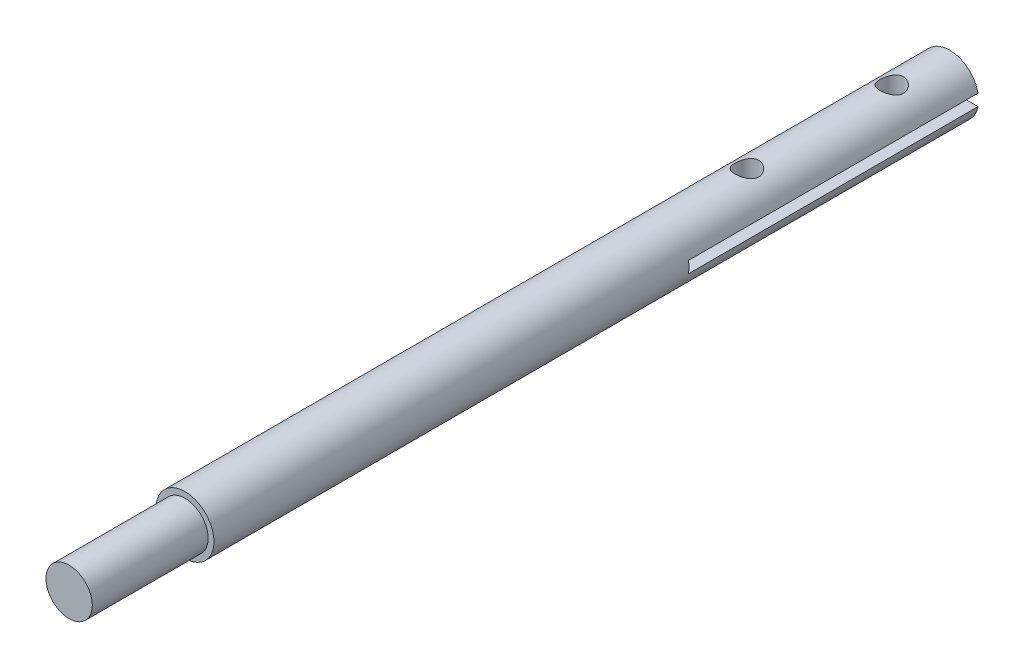
from build123d import *

# Parameters (mm, degrees)
SKETCH1_R               = 5
BOSS_EXTRUDE1_DEPTH     = 152
CUT_EXTRUDE2_DEPTH      = 153.164384795
CUT_EXTRUDE2_DEPTH_BACK = 153.164384795
SKETCH3_R               = 2.05
SKETCH5_W               = 15
SKETCH5_H               = 2
CUT_EXTRUDE4_DEPTH      = 50
SKETCH6_OUTSIDE_W       = 42.532
SKETCH6_OUTSIDE_H       = 42.532
SKETCH6_OUTSIDE_R       = 4
CUT_EXTRUDE5_DEPTH      = 20


with BuildPart() as part:
    # Sketch1 → Boss-Extrude1 (new body)
    with BuildSketch(Plane.XY):
        Circle(SKETCH1_R)
    extrude(amount=BOSS_EXTRUDE1_DEPTH)

    # Sketch3 → Cut-Extrude2 (cut, two sides: drawn at the far end of the back side and taken through both)
    with BuildSketch(Plane(origin=(0, 0, 0), x_dir=(1, 0, 0), z_dir=(0, 1, 0)).offset(-CUT_EXTRUDE2_DEPTH_BACK)):
        with Locations(Location((0, -10, 0), (0, 0, 270))):
            Circle(SKETCH3_R)
        with Locations(Location((0, -35, 0), (0, 0, 270))):
            Circle(SKETCH3_R)
    extrude(amount=CUT_EXTRUDE2_DEPTH + CUT_EXTRUDE2_DEPTH_BACK, mode=Mode.SUBTRACT)

    # Sketch5 → Cut-Extrude4 (cut)
    with BuildSketch(Plane(origin=(0, 0, 0), x_dir=(-1, 0, 0), z_dir=(0, 0, -1))):
        Rectangle(SKETCH5_W, SKETCH5_H)
    extrude(amount=-CUT_EXTRUDE4_DEPTH, mode=Mode.SUBTRACT)

    # Sketch6 outside → Cut-Extrude5 (cut)
    with BuildSketch(Plane.XY.offset(152)):
        Rectangle(SKETCH6_OUTSIDE_W, SKETCH6_OUTSIDE_H)
        Circle(SKETCH6_OUTSIDE_R, mode=Mode.SUBTRACT)
    extrude(amount=-CUT_EXTRUDE5_DEPTH, mode=Mode.SUBTRACT)


solid = part.part
